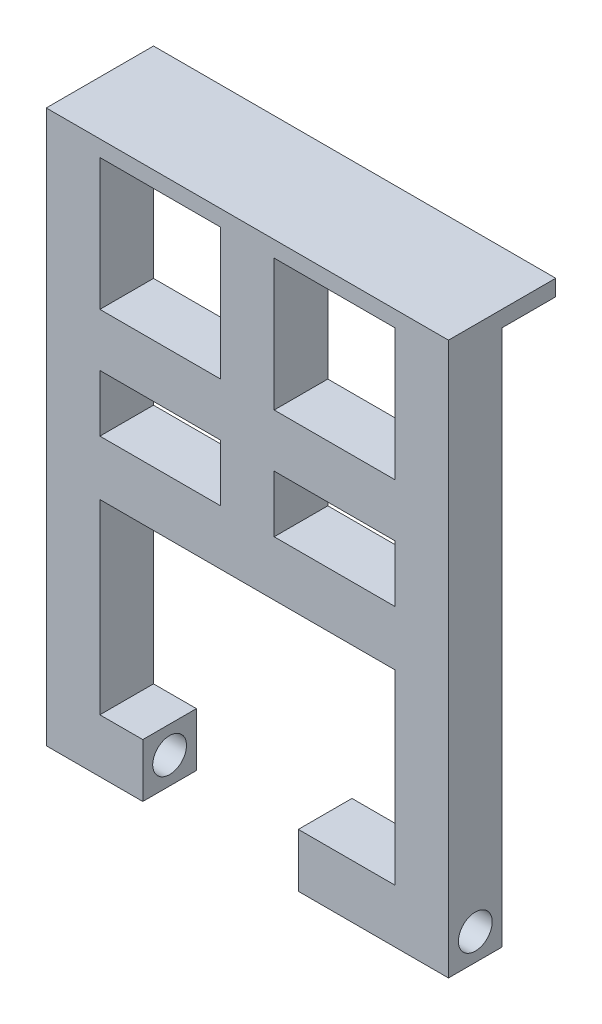
from build123d import *

# Parameters (mm, degrees)
SKETCH1_W               = 75
SKETCH1_H               = 20
BOSS_EXTRUDE1_DEPTH     = 3
SKETCH2_W               = 10
SKETCH2_H               = 100
BOSS_EXTRUDE2_DEPTH     = 10
SKETCH5_W               = 8
SKETCH5_H               = 10
SKETCH5_W_2             = 18
BOSS_EXTRUDE3_DEPTH     = 10
CUT_EXTRUDE1_DEPTH      = 117.828934772
CUT_EXTRUDE1_DEPTH_BACK = 117.828934772
SKETCH7_R               = 3.15
BOSS_EXTRUDE5_DEPTH     = 10


with BuildPart() as part:
    # Sketch1 → Boss-Extrude1 (new body)
    with BuildSketch(Plane(origin=(0, 0, 0), x_dir=(1, 0, 0), z_dir=(0, 1, 0))):
        with Locations((37.5, 10)):
            Rectangle(SKETCH1_W, SKETCH1_H)
    extrude(amount=BOSS_EXTRUDE1_DEPTH)

    # Sketch2 → Boss-Extrude2 (add)
    with BuildSketch(Plane.XY):
        with Locations((5, -50)):
            Rectangle(SKETCH2_W, SKETCH2_H)
        with Locations((70, -50)):
            Rectangle(SKETCH2_W, SKETCH2_H)
    extrude(amount=-BOSS_EXTRUDE2_DEPTH)

    # Sketch5 → Boss-Extrude3 (add)
    with BuildSketch(Plane.XY):
        with Locations((14, -95)):
            Rectangle(SKETCH5_W, SKETCH5_H)
        with Locations((56, -95)):
            Rectangle(SKETCH5_W_2, SKETCH5_H)
    extrude(amount=-BOSS_EXTRUDE3_DEPTH)

    # Sketch7 → Cut-Extrude1 (cut, two sides: drawn at the far end of the back side and taken through both)
    with BuildSketch(Plane(origin=(18, 0, 0), x_dir=(0, 0, -1), z_dir=(1, 0, 0)).offset(-CUT_EXTRUDE1_DEPTH_BACK)):
        with Locations((5, -95)):
            Circle(SKETCH7_R)
    extrude(amount=CUT_EXTRUDE1_DEPTH + CUT_EXTRUDE1_DEPTH_BACK, mode=Mode.SUBTRACT)

    # Sketch13 → Boss-Extrude5 (add)
    with BuildSketch(Plane.XY):
        Polygon((10, -24.530919021), (32.5, -24.530919021), (32.5, 0), (42.5, 0), (42.5, -24.530919021), (65, -24.530919021), (65, -34.394439552), (42.5, -34.394439552), (42.5, -45), (65, -45), (65, -55.233083722), (42.5, -55.233083722), (32.5, -55.233083722), (10, -55.233083722), (10, -45), (32.5, -45), (32.5, -34.394439552), (10, -34.394439552), align=None)
    extrude(amount=-BOSS_EXTRUDE5_DEPTH)


solid = part.part
